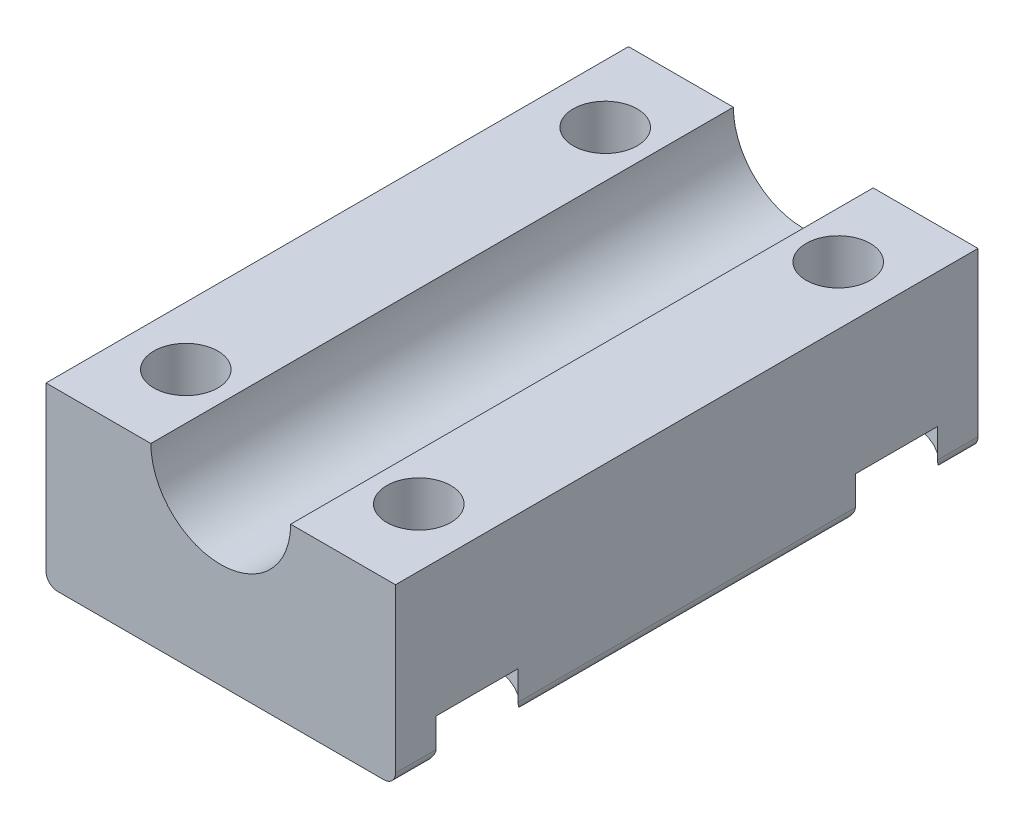
from build123d import *

# Parameters (mm, degrees)
BOSS_EXTRUDE2_DEPTH = 25
SKETCH2_R           = 6.12
CUT_EXTRUDE1_DEPTH  = 3.5
SKETCH2_3_R         = 2.75
CUT_EXTRUDE2_DEPTH  = 33.787192744


with BuildPart() as part:
    # Sketch1 → Boss-Extrude2 (new, symmetric)
    with BuildSketch(Plane.XY):
        with BuildLine():
            Line((6, 7.5), (15, 7.5))
            Line((15, 7.5), (15, -6.5))
            ThreePointArc((15, -6.5), (14.707106781, -7.207106781), (14, -7.5))
            Line((14, -7.5), (-14, -7.5))
            ThreePointArc((-14, -7.5), (-14.707106781, -7.207106781), (-15, -6.5))
            Line((-15, -6.5), (-15, 7.5))
            Line((-15, 7.5), (-6, 7.5))
            ThreePointArc((-6, 7.5), (0, 1.5), (6, 7.5))
        make_face()
    extrude(amount=BOSS_EXTRUDE2_DEPTH, both=True)

    # Sketch2 → Cut-Extrude1 (cut)
    with BuildSketch(Plane.XZ.offset(7.5)):
        with Locations((10, 18)):
            Circle(SKETCH2_R)
        with Locations((10, -18)):
            Circle(SKETCH2_R)
        with Locations((-10, -18)):
            Circle(SKETCH2_R)
        with Locations((-10, 18)):
            Circle(SKETCH2_R)
    extrude(amount=-CUT_EXTRUDE1_DEPTH, mode=Mode.SUBTRACT)

    # Sketch2<3> → Cut-Extrude2 (cut, through all)
    with BuildSketch(Plane.XZ.offset(7.5)):
        with Locations((10, 18)):
            Circle(SKETCH2_3_R)
        with Locations((10, -18)):
            Circle(SKETCH2_3_R)
        with Locations((-10, -18)):
            Circle(SKETCH2_3_R)
        with Locations((-10, 18)):
            Circle(SKETCH2_3_R)
    extrude(amount=-CUT_EXTRUDE2_DEPTH, mode=Mode.SUBTRACT)


solid = part.part
